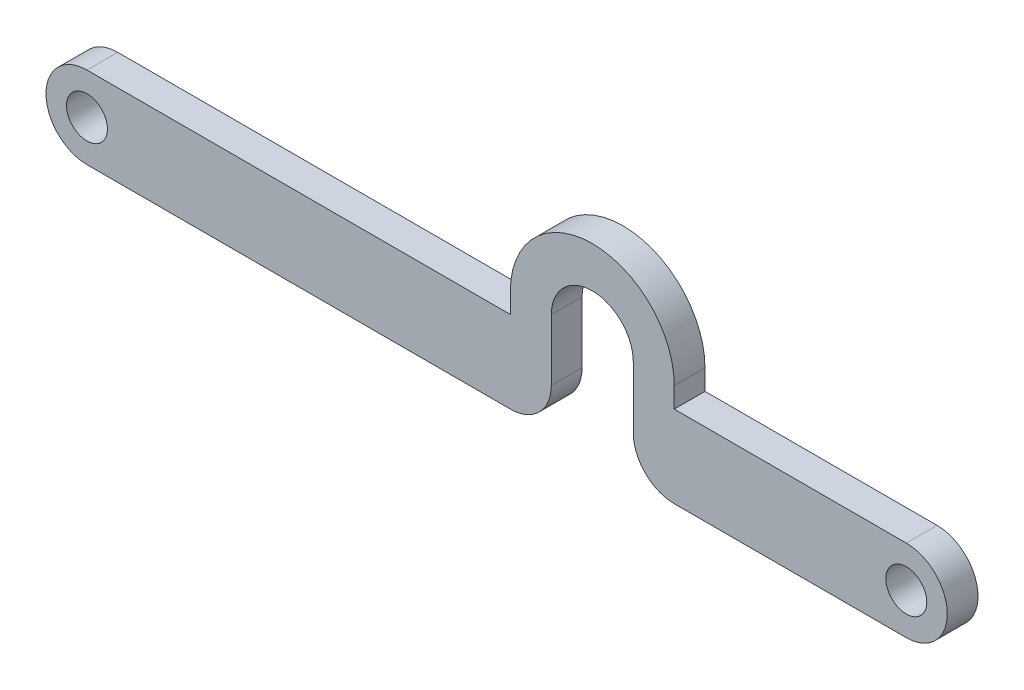
from build123d import *

# Parameters (mm, degrees)
SKETCH_1_R      = 1
EXTRUDE_1_DEPTH = 1.5


with BuildPart() as part:
    # 草图1 → 凸台-拉伸1 (new body)
    with BuildSketch(Plane.XY):
        with BuildLine():
            Line((28.670799108, 2), (40, 2))
            ThreePointArc((40, 2), (42, 0), (40, -2))
            Line((40, -2), (28.670799108, -2))
            ThreePointArc((28.670799108, -2), (27.256585545, -1.414213562), (26.670799108, 0))
            Line((26.670799108, 0), (26.670799108, 3))
            ThreePointArc((26.670799108, 3), (24.670799108, 5), (22.670799108, 3))
            Line((22.670799108, 3), (22.670799108, 0))
            ThreePointArc((22.670799108, 0), (22.08501267, -1.414213562), (20.670799108, -2))
            Line((20.670799108, -2), (0, -2))
            ThreePointArc((0, -2), (-2, 0), (0, 2))
            Line((0, 2), (20.670799108, 2))
            Line((20.670799108, 2), (20.670799108, 3))
            ThreePointArc((20.670799108, 3), (24.670799108, 7), (28.670799108, 3))
            Line((28.670799108, 3), (28.670799108, 2))
        make_face()
        with Locations((40, 0)):
            Circle(SKETCH_1_R, mode=Mode.SUBTRACT)
        Circle(SKETCH_1_R, mode=Mode.SUBTRACT)
    extrude(amount=EXTRUDE_1_DEPTH)


solid = part.part
